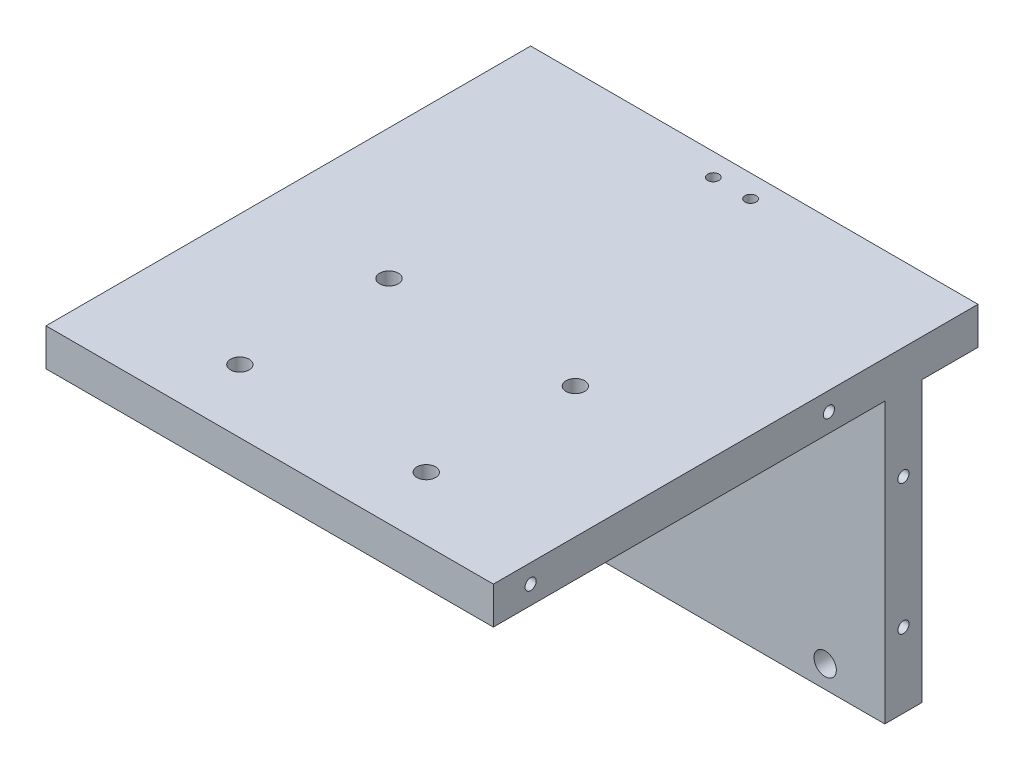
from build123d import *

# Parameters (mm, degrees)
SKETCH1_W           = 120
SKETCH1_H           = 75
SKETCH1_R           = 3
BOSS_EXTRUDE1_DEPTH = 10
SKETCH2_R           = 2.5
CUT_EXTRUDE1_DEPTH  = 10
SKETCH3_R           = 1.5
CUT_EXTRUDE2_DEPTH  = 10
LPATTERN1_COUNT     = 2
LPATTERN1_PITCH     = 110
SKETCH4_W           = 120
SKETCH4_H           = 130
BOSS_EXTRUDE2_DEPTH = 10
SKETCH5_R           = 1.5
CUT_EXTRUDE3_DEPTH  = 10
LPATTERN2_COUNT     = 2
LPATTERN2_PITCH     = 110
SKETCH6_R           = 2.5
CUT_EXTRUDE4_DEPTH  = 10
SKETCH7_R           = 1.5
CUT_EXTRUDE5_DEPTH  = 10


with BuildPart() as part:
    # Sketch1 → Boss-Extrude1 (new body)
    with BuildSketch(Plane.XY):
        Rectangle(SKETCH1_W, SKETCH1_H)
        with Locations((-44, 31.5)):
            Circle(SKETCH1_R, mode=Mode.SUBTRACT)
        with Locations((44, 31.5)):
            Circle(SKETCH1_R, mode=Mode.SUBTRACT)
        with Locations((-44, -31.5)):
            Circle(SKETCH1_R, mode=Mode.SUBTRACT)
        with Locations((44, -31.5)):
            Circle(SKETCH1_R, mode=Mode.SUBTRACT)
    extrude(amount=BOSS_EXTRUDE1_DEPTH)

    # Sketch2 → Cut-Extrude1 (cut)
    with BuildSketch(Plane.XY.offset(10)):
        with Locations((0, 10)):
            Circle(SKETCH2_R)
        with Locations((0, -10)):
            Circle(SKETCH2_R)
    extrude(amount=-CUT_EXTRUDE1_DEPTH, mode=Mode.SUBTRACT)

    # Sketch3 → Cut-Extrude2 (cut)
    with BuildSketch(Plane(origin=(60, 0, 0), x_dir=(0, 0, -1), z_dir=(1, 0, 0))):
        with Locations(Location((-5, 17.5, 0), (0, 0, 90))):
            Circle(SKETCH3_R)
        with Locations(Location((-5, -17.5, 0), (0, 0, 90))):
            Circle(SKETCH3_R)
    cut_extrude2 = extrude(amount=-CUT_EXTRUDE2_DEPTH, mode=Mode.SUBTRACT)

    # LPattern1: Cut-Extrude2 ×2
    with Locations(*[(-i * LPATTERN1_PITCH, 0, 0) for i in range(1, LPATTERN1_COUNT)]):
        add(cut_extrude2, mode=Mode.SUBTRACT)

    # Sketch4 → Boss-Extrude2 (add)
    with BuildSketch(Plane(origin=(0, 37.5, 0), x_dir=(1, 0, 0), z_dir=(0, 1, 0))):
        with Locations((0, -50)):
            Rectangle(SKETCH4_W, SKETCH4_H)
    extrude(amount=BOSS_EXTRUDE2_DEPTH)

    # Sketch5 → Cut-Extrude3 (cut)
    with BuildSketch(Plane(origin=(60, 0, 0), x_dir=(0, 0, -1), z_dir=(1, 0, 0))):
        with Locations(Location((-105, 42.5, 0), (0, 0, 90))):
            Circle(SKETCH5_R)
        with Locations(Location((-25, 42.5, 0), (0, 0, 90))):
            Circle(SKETCH5_R)
    cut_extrude3 = extrude(amount=-CUT_EXTRUDE3_DEPTH, mode=Mode.SUBTRACT)

    # LPattern2: Cut-Extrude3 ×2
    with Locations(*[(-i * LPATTERN2_PITCH, 0, 0) for i in range(1, LPATTERN2_COUNT)]):
        add(cut_extrude3, mode=Mode.SUBTRACT)

    # Sketch6 → Cut-Extrude4 (cut)
    with BuildSketch(Plane(origin=(0, 47.5, 0), x_dir=(1, 0, 0), z_dir=(0, 1, 0))):
        with Locations(Location((-25, -98, 0), (0, 0, 270))):
            Circle(SKETCH6_R)
        with Locations(Location((25, -98, 0), (0, 0, 270))):
            Circle(SKETCH6_R)
        with Locations(Location((-25, -58, 0), (0, 0, 270))):
            Circle(SKETCH6_R)
        with Locations(Location((25, -58, 0), (0, 0, 270))):
            Circle(SKETCH6_R)
    extrude(amount=-CUT_EXTRUDE4_DEPTH, mode=Mode.SUBTRACT)

    # Sketch7 → Cut-Extrude5 (cut)
    with BuildSketch(Plane(origin=(0, 47.5, 0), x_dir=(1, 0, 0), z_dir=(0, 1, 0))):
        with Locations(Location((-5, 9, 0), (0, 0, 270))):
            Circle(SKETCH7_R)
        with Locations(Location((5, 9, 0), (0, 0, 270))):
            Circle(SKETCH7_R)
    extrude(amount=-CUT_EXTRUDE5_DEPTH, mode=Mode.SUBTRACT)


solid = part.part
